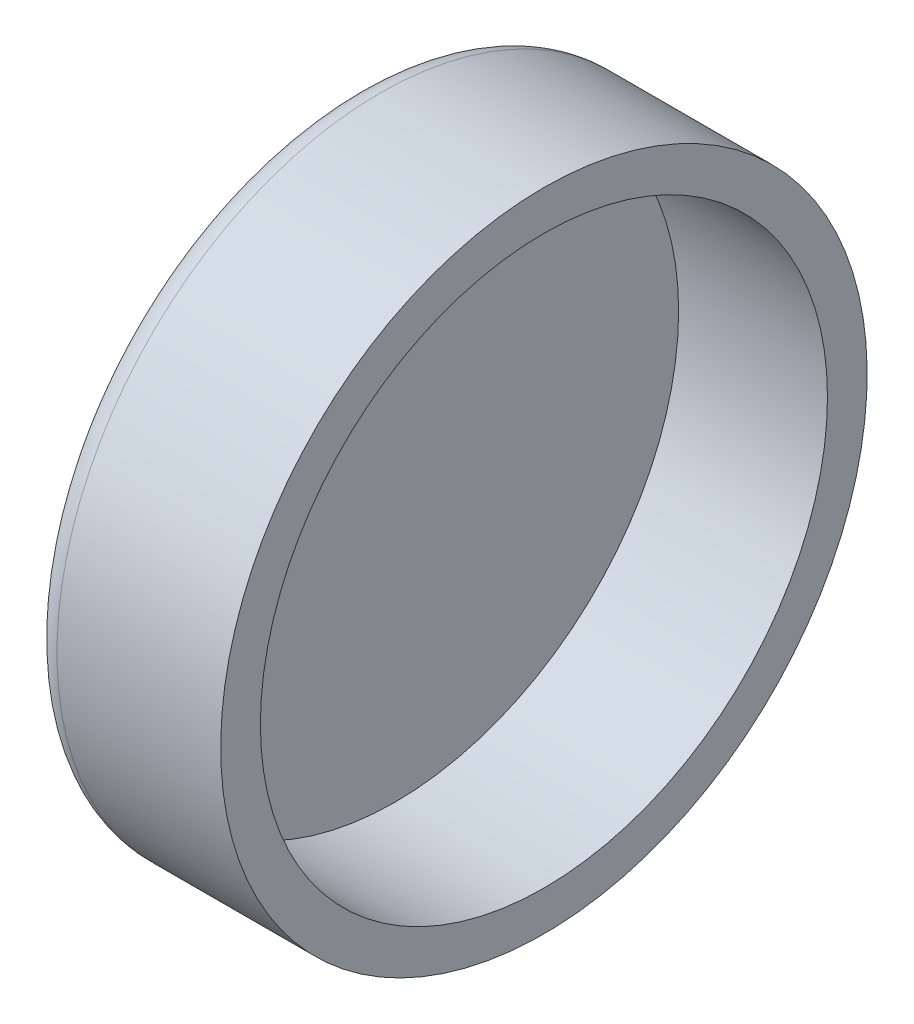
from build123d import *

# Parameters (mm, degrees)
REDONDEO1_R = 5


with BuildPart() as part:
    # Croquis2 → Revolución1 (revolve)
    with BuildSketch(Plane.XY):
        Polygon((0, 57.15), (-30, 57.15), (-30, 0), (-38, 0), (-38, 65.15), (0, 65.15), align=None)
    revolve(axis=Axis((-30, 0, 0), (-1, 0, 0)))

    # Redondeo1
    redondeo1_edges = [part.edges().sort_by_distance(p)[0] for p in [
        (-38, -65.15, 0),
    ]]
    fillet(redondeo1_edges, radius=REDONDEO1_R)


solid = part.part
